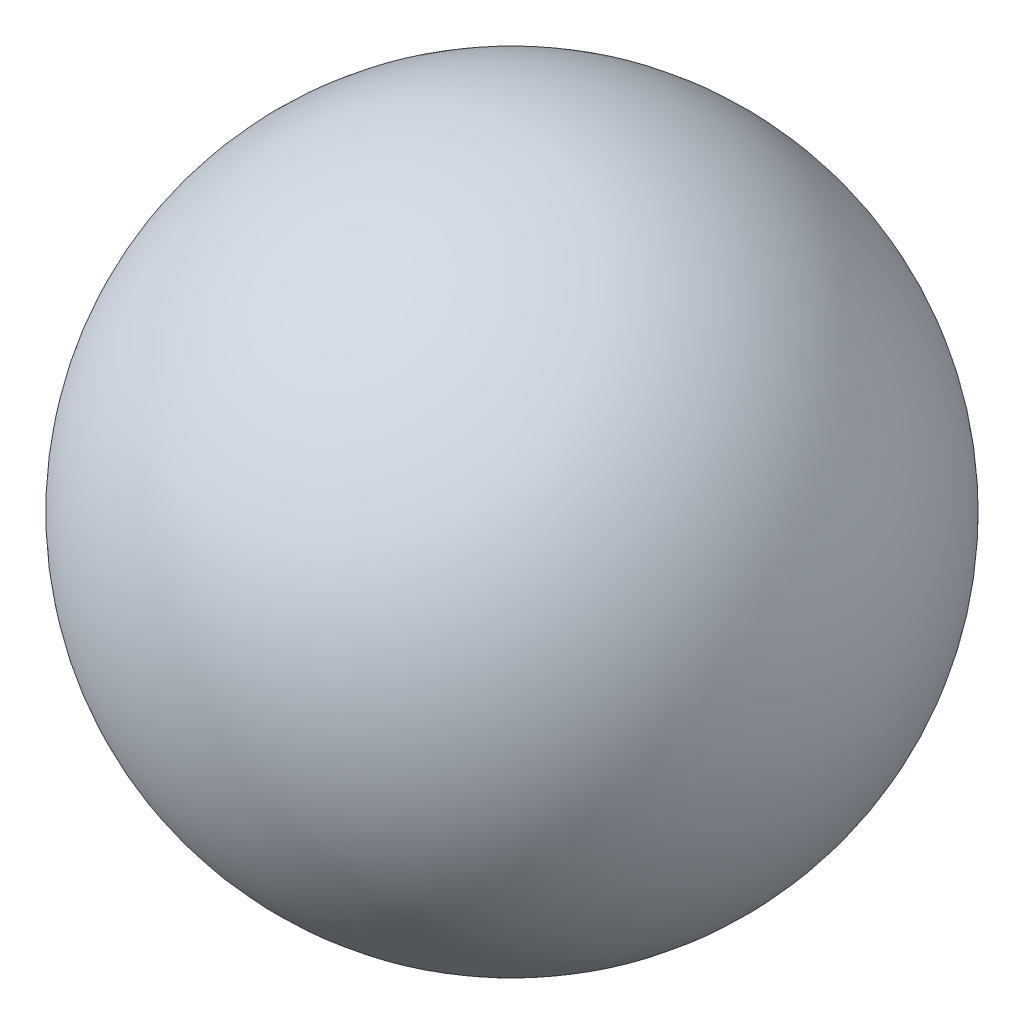
from build123d import *


with BuildPart() as part:
    # Sketch1 → Revolve1 (revolve)
    with BuildSketch(Plane.XY):
        with BuildLine():
            Line((0, -8.1), (0, 8.1))
            ThreePointArc((0, 8.1), (8.1, 0), (0, -8.1))
        make_face()
    revolve(axis=Axis((0, -8.1, 0), (0, 1, 0)))


solid = part.part
